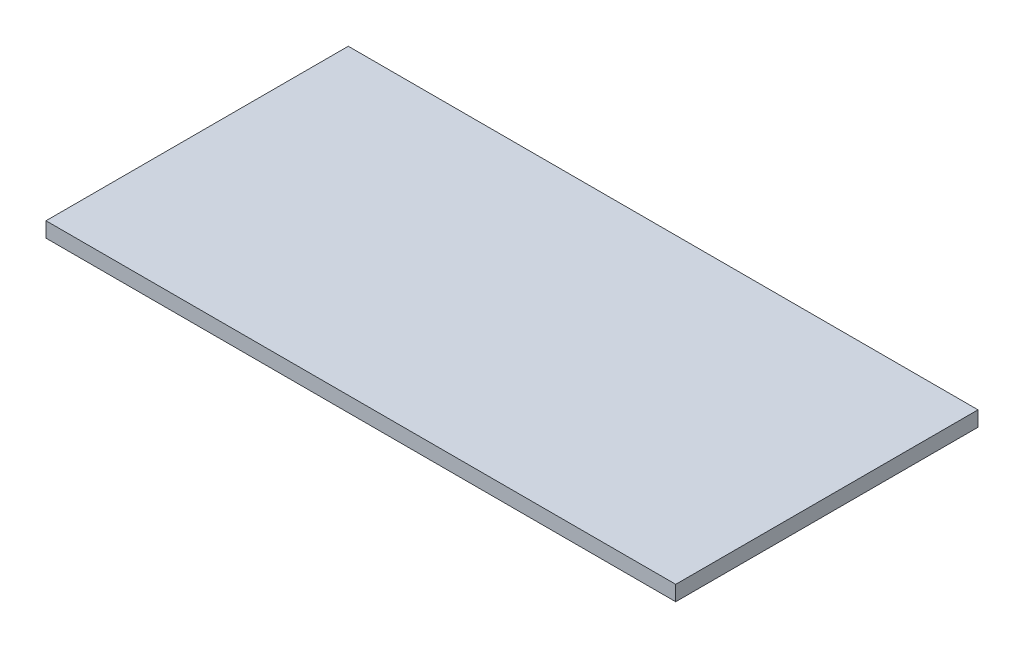
from build123d import *

# Parameters (mm, degrees)
SKETCH_1_W      = 250
SKETCH_1_H      = 120
EXTRUDE_1_DEPTH = 6


with BuildPart() as part:
    # Эскиз1 → Бобышка-Вытянуть1 (new body)
    with BuildSketch(Plane(origin=(0, 0, 0), x_dir=(1, 0, 0), z_dir=(0, 1, 0))):
        Rectangle(SKETCH_1_W, SKETCH_1_H)
    extrude(amount=EXTRUDE_1_DEPTH)


solid = part.part
